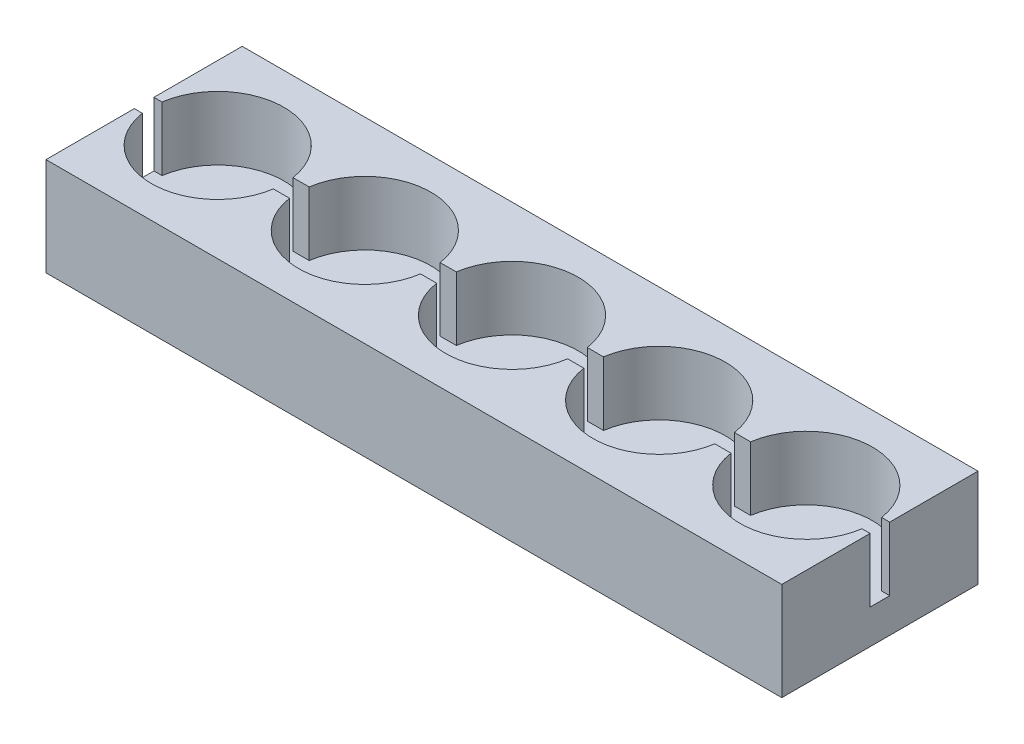
from build123d import *

# Parameters (mm, degrees)
SKETCH2_W                                           = 150
SKETCH2_H                                           = 40
BOSS_EXTRUDE1_DEPTH                                 = 20
SKETCH3_R                                           = 13.5
CUT_EXTRUDE1_DEPTH                                  = 13
LPATTERN1_COUNT                                     = 5
LPATTERN1_PITCH                                     = 30
CBORE_FOR_M4_HEX_SOCKET_HEAD_CAP_SCREW1_D           = 4.5
CBORE_FOR_M4_HEX_SOCKET_HEAD_CAP_SCREW1_CBORE_D     = 8
CBORE_FOR_M4_HEX_SOCKET_HEAD_CAP_SCREW1_CBORE_DEPTH = 4.4
LPATTERN2_COUNT                                     = 2
LPATTERN2_PITCH                                     = 120
SKETCH7_W                                           = 181.12901383
SKETCH7_H                                           = 4
CUT_EXTRUDE3_DEPTH                                  = 13


with BuildPart() as part:
    # Sketch2 → Boss-Extrude1 (new body)
    with BuildSketch(Plane(origin=(0, 0, 0), x_dir=(1, 0, 0), z_dir=(0, 1, 0))):
        Rectangle(SKETCH2_W, SKETCH2_H)
    extrude(amount=BOSS_EXTRUDE1_DEPTH)

    # Sketch3 → Cut-Extrude1 (cut)
    with BuildSketch(Plane(origin=(0, 20, 0), x_dir=(1, 0, 0), z_dir=(0, 1, 0))):
        with Locations(Location((-60, 0, 0), (0, 0, 270))):
            Circle(SKETCH3_R)
    cut_extrude1 = extrude(amount=-CUT_EXTRUDE1_DEPTH, mode=Mode.SUBTRACT)

    # LPattern1: Cut-Extrude1 ×5
    with Locations(*[(i * LPATTERN1_PITCH, 0, 0) for i in range(1, LPATTERN1_COUNT)]):
        add(cut_extrude1, mode=Mode.SUBTRACT)

    # CBORE for M4 Hex Socket Head Cap Screw1 (through all)
    with Locations(Plane(origin=(0, 7, 0), x_dir=(-1, 0, 0), z_dir=(0, 1, 0))):
        with Locations((60, 0)):
            cbore_for_m4_hex_socket_head_cap_screw1 = CounterBoreHole(CBORE_FOR_M4_HEX_SOCKET_HEAD_CAP_SCREW1_D / 2, CBORE_FOR_M4_HEX_SOCKET_HEAD_CAP_SCREW1_CBORE_D / 2, CBORE_FOR_M4_HEX_SOCKET_HEAD_CAP_SCREW1_CBORE_DEPTH)

    # LPattern2: CBORE for M4 Hex Socket Head Cap Screw1 ×2
    with Locations(*[(i * LPATTERN2_PITCH, 0, 0) for i in range(1, LPATTERN2_COUNT)]):
        add(cbore_for_m4_hex_socket_head_cap_screw1, mode=Mode.SUBTRACT)

    # Sketch7 → Cut-Extrude3 (cut)
    with BuildSketch(Plane(origin=(0, 20, 0), x_dir=(1, 0, 0), z_dir=(0, 1, 0))):
        Rectangle(SKETCH7_W, SKETCH7_H)
    extrude(amount=-CUT_EXTRUDE3_DEPTH, mode=Mode.SUBTRACT)


solid = part.part
